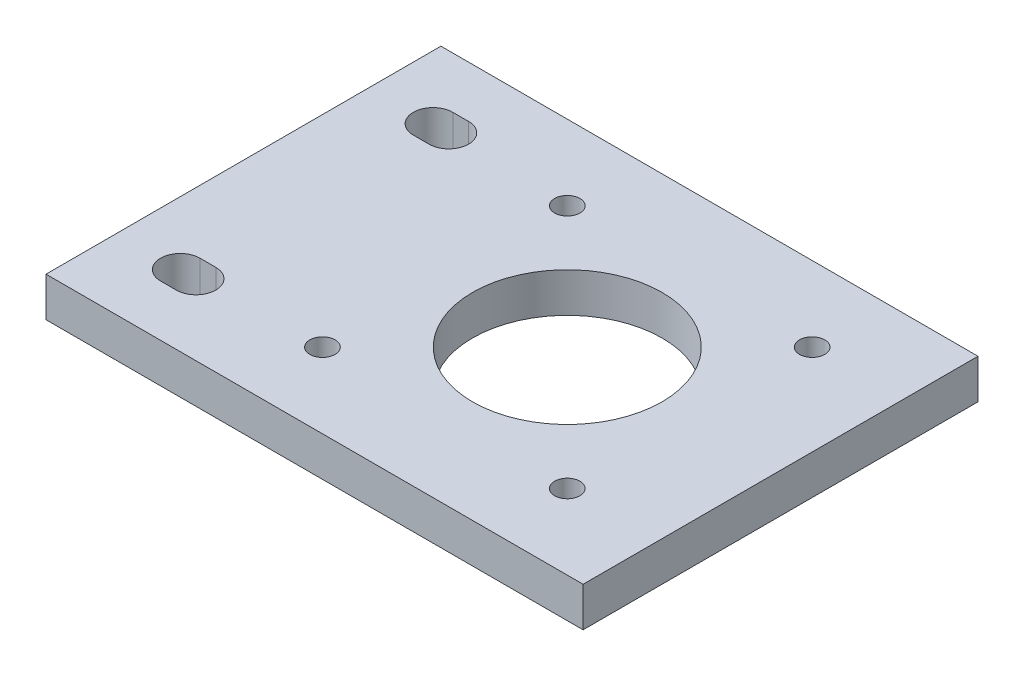
from build123d import *

# Parameters (mm, degrees)
SKETCH_1_W      = 68
SKETCH_1_H      = 50
SKETCH_1_R      = 12
SKETCH_1_R_2    = 1.6
EXTRUDE_1_DEPTH = 5


with BuildPart() as part:
    # 草图1 → 凸台-拉伸1 (new body)
    with BuildSketch(Plane(origin=(0, 0, 0), x_dir=(1, 0, 0), z_dir=(0, 1, 0))):
        with Locations((34, -25)):
            Rectangle(SKETCH_1_W, SKETCH_1_H)
        with Locations(Location((41, -25, 0), (0, 0, 270))):
            Circle(SKETCH_1_R, mode=Mode.SUBTRACT)
        with Locations(Location((25.5, -9.5, 0), (0, 0, 270))):
            Circle(SKETCH_1_R_2, mode=Mode.SUBTRACT)
        with Locations(Location((56.5, -9.5, 0), (0, 0, 270))):
            Circle(SKETCH_1_R_2, mode=Mode.SUBTRACT)
        with Locations(Location((56.5, -40.5, 0), (0, 0, 270))):
            Circle(SKETCH_1_R_2, mode=Mode.SUBTRACT)
        with Locations(Location((25.5, -40.5, 0), (0, 0, 270))):
            Circle(SKETCH_1_R_2, mode=Mode.SUBTRACT)
        with BuildLine():
            Line((8, -6.5), (10, -6.5))
            ThreePointArc((10, -6.5), (12.5, -9), (10, -11.5))
            Line((10, -11.5), (8, -11.5))
            ThreePointArc((8, -11.5), (5.5, -9), (8, -6.5))
        make_face(mode=Mode.SUBTRACT)
        with BuildLine():
            Line((8, -38.5), (10, -38.5))
            ThreePointArc((10, -38.5), (12.5, -41), (10, -43.5))
            Line((10, -43.5), (8, -43.5))
            ThreePointArc((8, -43.5), (5.5, -41), (8, -38.5))
        make_face(mode=Mode.SUBTRACT)
    extrude(amount=EXTRUDE_1_DEPTH)


solid = part.part
